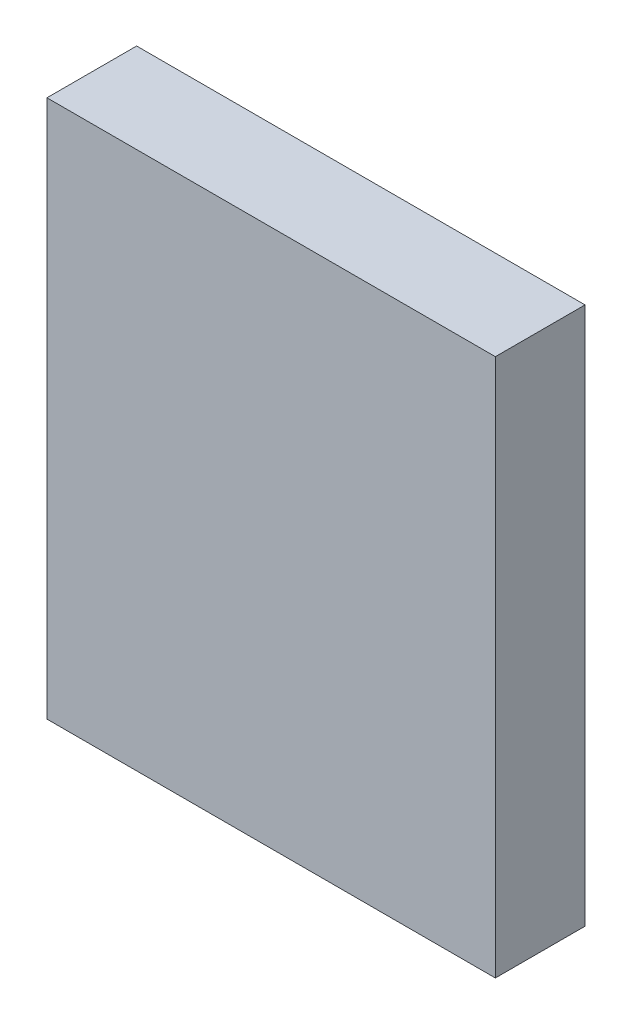
from build123d import *

# Parameters (mm, degrees)
SKETCH_1_W      = 50
SKETCH_1_H      = 60
EXTRUDE_1_DEPTH = 10


with BuildPart() as part:
    # 草图1 → 凸台-拉伸1 (new body)
    with BuildSketch(Plane.XY.offset(12)):
        with Locations((25, 30)):
            Rectangle(SKETCH_1_W, SKETCH_1_H)
    extrude(amount=-EXTRUDE_1_DEPTH)


solid = part.part
